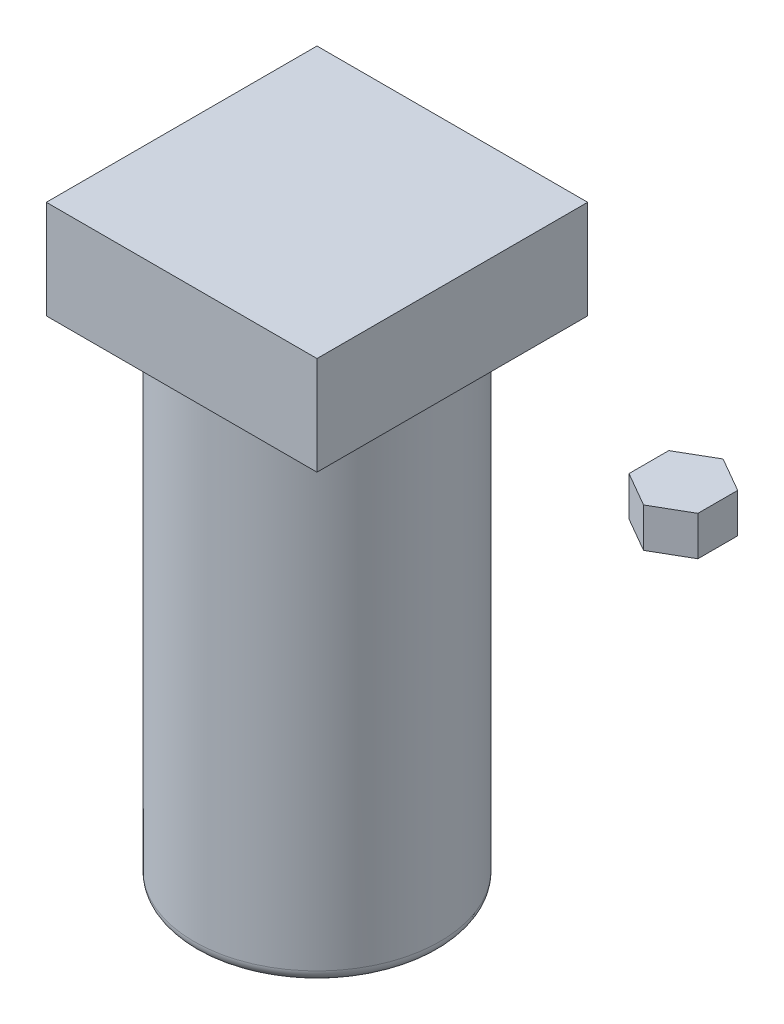
from build123d import *

# Parameters (mm, degrees)
SKETCH1_W           = 34.925
SKETCH1_H           = 34.925
BOSS_EXTRUDE1_DEPTH = 12.7
SKETCH3_R           = 15.875
SKETCH3_R_2         = 12.7
BOSS_EXTRUDE2_DEPTH = 63.5
FILLET1_R           = 1.524
BOSS_EXTRUDE3_DEPTH = 5.08


with BuildPart() as part:
    # Sketch1 → Boss-Extrude1 (new body)
    with BuildSketch(Plane(origin=(0, 0, 0), x_dir=(1, 0, 0), z_dir=(0, 1, 0))):
        Rectangle(SKETCH1_W, SKETCH1_H)
    extrude(amount=BOSS_EXTRUDE1_DEPTH)

    # Sketch3 → Boss-Extrude2 (add)
    with BuildSketch(Plane.XZ):
        with Locations(Location((0, 0, 0), (0, 0, 90))):
            Circle(SKETCH3_R)
        with Locations(Location((0, 0, 0), (0, 0, 270))):
            Circle(SKETCH3_R_2, mode=Mode.SUBTRACT)
    extrude(amount=BOSS_EXTRUDE2_DEPTH)

    # Fillet1
    fillet1_edges = [part.edges().sort_by_distance(p)[0] for p in [
        (0, -63.5, -15.875),
    ]]
    fillet(fillet1_edges, radius=FILLET1_R)


with BuildPart() as body_2:
    # Sketch5 → Boss-Extrude3 (new body)
    with BuildSketch(Plane(origin=(0, 0, 0), x_dir=(1, 0, 0), z_dir=(0, 1, 0))):
        Polygon((47.271077343, -5.132643893), (51.716077343, -2.566321947), (51.716077343, 2.566321947), (47.271077343, 5.132643893), (42.826077343, 2.566321947), (42.826077343, -2.566321947), align=None)
    extrude(amount=BOSS_EXTRUDE3_DEPTH)


solid = Compound([part.part, body_2.part])
